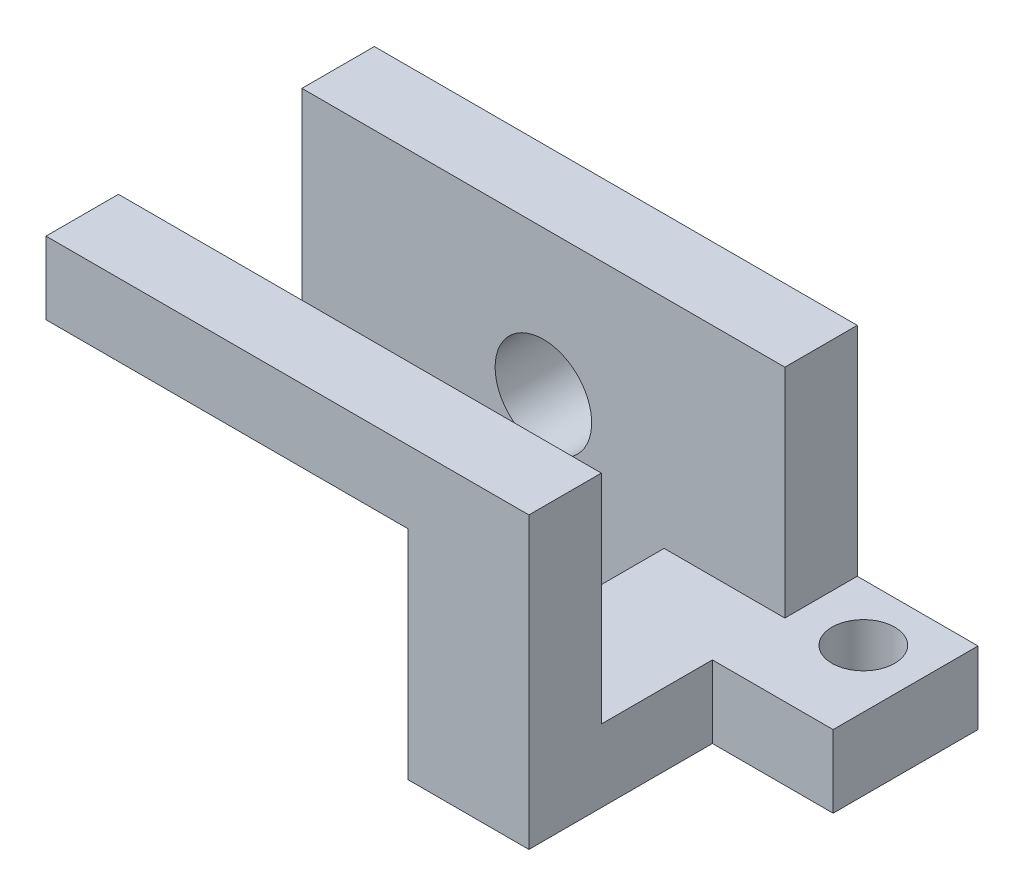
from build123d import *

# Parameters (mm, degrees)
SKETCH1_W           = 100
SKETCH1_H           = 60
BOSS_EXTRUDE1_DEPTH = 15
SKETCH2_W           = 25
SKETCH2_H           = 15
BOSS_EXTRUDE2_DEPTH = 38
SKETCH4_W           = 100
SKETCH4_H           = 60
BOSS_EXTRUDE3_DEPTH = 15
SKETCH5_W           = 75
SKETCH5_H           = 45
CUT_EXTRUDE1_DEPTH  = 15
SKETCH6_W           = 30
SKETCH6_H           = 15
BOSS_EXTRUDE4_DEPTH = 25
SKETCH7_R           = 6.5
CUT_EXTRUDE2_DEPTH  = 15
SKETCH8_R           = 10
CUT_EXTRUDE3_DEPTH  = 15


with BuildPart() as part:
    # Sketch1 → Boss-Extrude1 (new body)
    with BuildSketch(Plane.XY):
        with Locations((-50, 30)):
            Rectangle(SKETCH1_W, SKETCH1_H)
    extrude(amount=BOSS_EXTRUDE1_DEPTH)

    # Sketch2 → Boss-Extrude2 (add)
    with BuildSketch(Plane.XY.offset(15)):
        with Locations((-12.5, 7.5)):
            Rectangle(SKETCH2_W, SKETCH2_H)
    extrude(amount=BOSS_EXTRUDE2_DEPTH)

    # Sketch4 → Boss-Extrude3 (add)
    with BuildSketch(Plane.XY.offset(53)):
        with Locations((-50, 30)):
            Rectangle(SKETCH4_W, SKETCH4_H)
    extrude(amount=BOSS_EXTRUDE3_DEPTH)

    # Sketch5 → Cut-Extrude1 (cut)
    with BuildSketch(Plane(origin=(0, 0, 53), x_dir=(-1, 0, 0), z_dir=(0, 0, -1))):
        with Locations((62.5, 22.5)):
            Rectangle(SKETCH5_W, SKETCH5_H)
    extrude(amount=-CUT_EXTRUDE1_DEPTH, mode=Mode.SUBTRACT)

    # Sketch6 → Boss-Extrude4 (add)
    with BuildSketch(Plane(origin=(0, 0, 0), x_dir=(0, 0, -1), z_dir=(1, 0, 0))):
        with Locations((-15, 7.5)):
            Rectangle(SKETCH6_W, SKETCH6_H)
    extrude(amount=BOSS_EXTRUDE4_DEPTH)

    # Sketch7 → Cut-Extrude2 (cut)
    with BuildSketch(Plane(origin=(0, 15, 0), x_dir=(1, 0, 0), z_dir=(0, 1, 0))):
        with Locations(Location((13, -11.741405252, 0), (0, 0, 180))):
            Circle(SKETCH7_R)
    extrude(amount=-CUT_EXTRUDE2_DEPTH, mode=Mode.SUBTRACT)

    # Sketch8 → Cut-Extrude3 (cut)
    with BuildSketch(Plane(origin=(0, 0, 0), x_dir=(-1, 0, 0), z_dir=(0, 0, -1))):
        with Locations((50, 30)):
            Circle(SKETCH8_R)
    extrude(amount=-CUT_EXTRUDE3_DEPTH, mode=Mode.SUBTRACT)


solid = part.part
